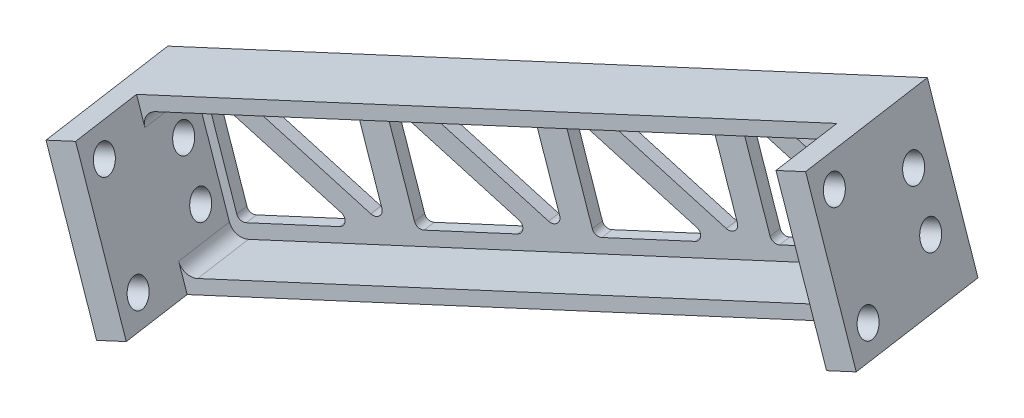
from build123d import *

# Parameters (mm, degrees)
SKETCH2_W                       = 38.1
SKETCH2_H                       = 38.1
BOSS_EXTRUDE1_DEPTH             = 6.35
BOSS_EXTRUDE2_DEPTH             = 156.456983
SKETCH4_W                       = 38.1
SKETCH4_H                       = 38.1
BOSS_EXTRUDE3_DEPTH             = 6.35
FILLET1_R                       = 3.175
F_1_4_0_25_DIAMETER_HOLE1_D     = 6.35
F_1_4_0_25_DIAMETER_HOLE1_DEPTH = 25.603542527
CUT_EXTRUDE1_REACH              = 187.255
LPATTERN1_COUNT                 = 4
LPATTERN1_PITCH                 = 38.1


with BuildPart() as part:
    # Sketch2 → Boss-Extrude1 (new body)
    with BuildSketch(Plane(origin=(0, 0, 0), x_dir=(0.1994825347085473, 0.06819943394704729, 0.9775252199076787), z_dir=(-0.924962461700774, -0.31622776601683794, 0.21081851067789195))):
        Rectangle(SKETCH2_W, SKETCH2_H)
    extrude(amount=BOSS_EXTRUDE1_DEPTH)

    # Sketch3 → Boss-Extrude2 (add)
    with BuildSketch(Plane(origin=(-5.873511632, -2.008046314, 1.338697543), x_dir=(0.19948253470854727, 0.06819943394704733, 0.9775252199076787), z_dir=(-0.9249624617007739, -0.316227766016838, 0.21081851067789192))):
        Polygon((-15.875, -15.875), (0, -15.875), (0, -19.05), (-19.05, -19.05), (-19.05, 19.05), (0, 19.05), (0, 15.875), (-15.875, 15.875), align=None)
    extrude(amount=BOSS_EXTRUDE2_DEPTH)

    # Sketch4 → Boss-Extrude3 (add)
    with BuildSketch(Plane(origin=(-150.590347718, -51.484088506, 34.32272567), x_dir=(0.19948253470854724, 0.06819943394704728, 0.9775252199076787), z_dir=(-0.924962461700774, -0.31622776601683794, 0.2108185106778919))):
        Rectangle(SKETCH4_W, SKETCH4_H)
    extrude(amount=-BOSS_EXTRUDE3_DEPTH)

    # Fillet1
    fillet1_edges = [part.edges().sort_by_distance(p)[0] for p in [
        (-2.321368427, -17.570760643, -6.42040889),
        (-12.592440075, 12.472002, -6.42040889),
        (-141.164692882, -65.03875652, 25.224921695),
        (-151.435764529, -34.995993877, 25.224921695),
    ]]
    fillet(fillet1_edges, radius=FILLET1_R)

    # 1/4 (0.25) Diameter Hole1
    with Locations(Plane(origin=(-144.716836086, -49.476042191, 32.984028128), x_dir=(-0.19948253470854763, -0.06819943394704747, -0.9775252199076786), z_dir=(0.924962461700774, 0.3162277660168374, -0.2108185106778923))):
        with Locations((9.525, -6.35), (-12.7, -12.7), (-12.7, 12.7), (9.47011661, 6.35)):
            f_1_4_0_25_diameter_hole1 = Hole(F_1_4_0_25_DIAMETER_HOLE1_D / 2, depth=F_1_4_0_25_DIAMETER_HOLE1_DEPTH)

    # Mirror1: 1/4 (0.25) Diameter Hole1 across plane
    add(f_1_4_0_25_diameter_hole1.mirror(Plane(origin=(-75.295173859, -25.742044253, 17.161362835), x_dir=(0.19948253470854732, 0.06819943394704736, 0.9775252199076787), z_dir=(0.924962461700774, 0.316227766016838, -0.21081851067789195))), mode=Mode.SUBTRACT)

    # Sketch9 → Cut-Extrude1 (cut, up to next)
    with BuildSketch(Plane(origin=(-3.166785238, -1.082666014, -15.518212866), x_dir=(0.9799013819493537, -0.013883637884437966, -0.19899880967694392), z_dir=(0.19948253470854727, 0.06819943394704746, 0.9775252199076788)), mode=Mode.PRIVATE) as cut_extrude1_sk1:
        with BuildLine():
            Line((-4.984618665, -11.137455788), (-11.58066581, 7.722289794))
            ThreePointArc((-11.58066581, 7.722289794), (-12.390150485, 8.628384663), (-13.603248415, 8.696698385))
            Line((-13.603248415, 8.696698385), (-32.462993997, 2.100651241))
            ThreePointArc((-32.462993997, 2.100651241), (-33.523895818, 0.691411823), (-32.627917913, -0.828026233))
            Line((-32.627917913, -0.828026233), (-7.172125187, -13.091724671))
            ThreePointArc((-7.172125187, -13.091724671), (-5.425471566, -12.845412794), (-4.984618665, -11.137455788))
        make_face()
    cut_extrude1_tool1 = extrude(cut_extrude1_sk1.sketch, amount=-CUT_EXTRUDE1_REACH, mode=Mode.PRIVATE) & part.part
    # Sketch9 → Cut-Extrude1 (cut, up to next)
    with BuildSketch(Plane(origin=(-3.166785238, -1.082666014, -15.518212866), x_dir=(0.9799013819493537, -0.013883637884437966, -0.19899880967694392), z_dir=(0.19948253470854727, 0.06819943394704746, 0.9775252199076788)), mode=Mode.PRIVATE) as cut_extrude1_sk2:
        with BuildLine():
            Line((-38.621900308, -2.924374261), (-13.166107581, -15.188072699))
            ThreePointArc((-13.166107581, -15.188072699), (-12.270129676, -16.707510755), (-13.331031497, -18.116750174))
            Line((-13.331031497, -18.116750174), (-32.190777079, -24.712797318))
            ThreePointArc((-32.190777079, -24.712797318), (-33.403875009, -24.644483595), (-34.213359685, -23.738388726))
            Line((-34.213359685, -23.738388726), (-40.809406829, -4.878643144))
            ThreePointArc((-40.809406829, -4.878643144), (-40.368553929, -3.170686139), (-38.621900308, -2.924374261))
        make_face()
    cut_extrude1_tool2 = extrude(cut_extrude1_sk2.sketch, amount=-CUT_EXTRUDE1_REACH, mode=Mode.PRIVATE) & part.part
    cut_extrude1_1 = cut_extrude1_tool1.solids().sort_by_distance((-20.084687, -2.329504, -11.978806))[0]
    add(cut_extrude1_1, mode=Mode.SUBTRACT)
    cut_extrude1_2 = cut_extrude1_tool2.solids().sort_by_distance((-31.122512, -15.177301, -8.829971))[0]
    add(cut_extrude1_2, mode=Mode.SUBTRACT)
    cut_extrude1 = cut_extrude1_1 + cut_extrude1_2  # Cut-Extrude1 as one shape, for the pattern or mirror that repeats it

    # LPattern1: Cut-Extrude1 ×4
    with Locations(*[Vector(-0.924962461700774, -0.3162277660168377, 0.210818510677892) * (i * LPATTERN1_PITCH) for i in range(1, LPATTERN1_COUNT)]):
        add(cut_extrude1, mode=Mode.SUBTRACT)


solid = part.part
